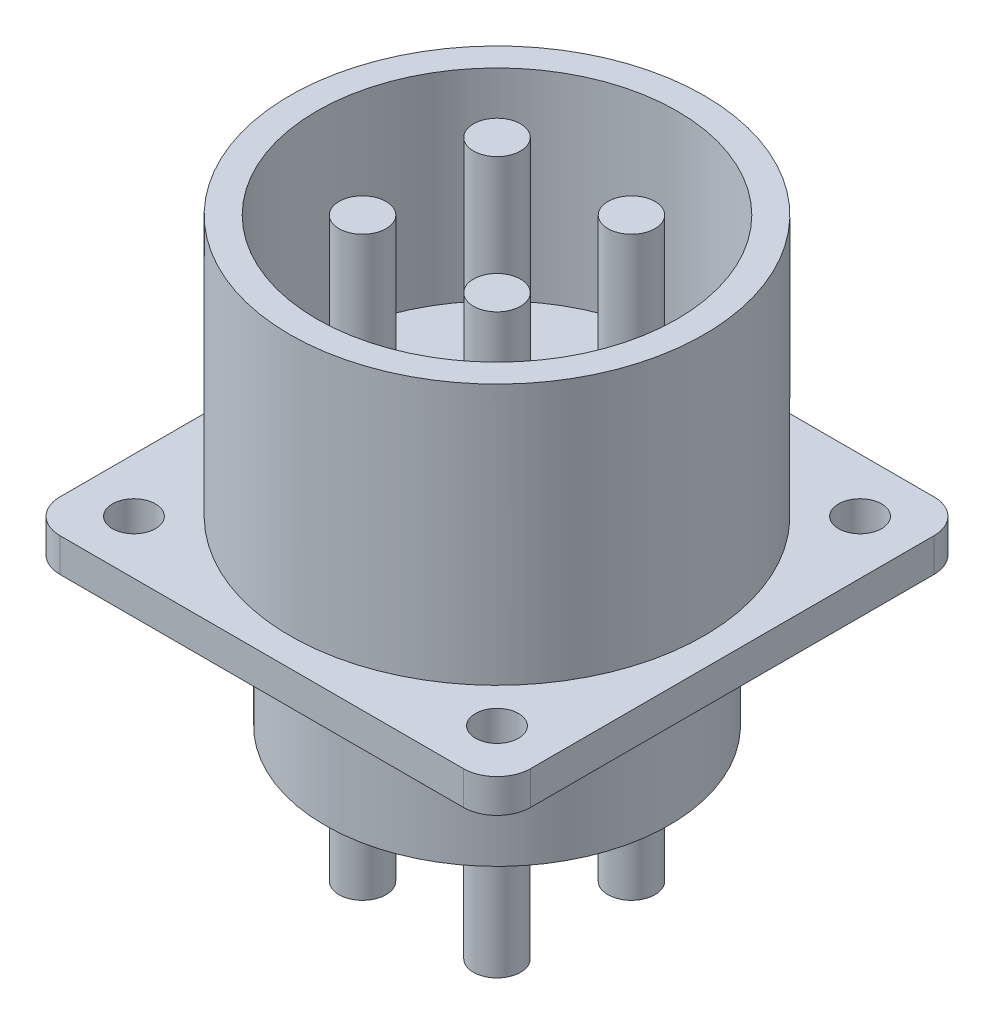
from build123d import *

# Parameters (mm, degrees)
SKETCH1_W           = 35
SKETCH1_H           = 35
BOSS_EXTRUDE1_DEPTH = 2.5
FILLET1_R           = 2.5
SKETCH2_R           = 15.4
BOSS_EXTRUDE2_DEPTH = 19.4
SKETCH3_R           = 12.8
BOSS_EXTRUDE3_DEPTH = 11
SKETCH4_R           = 13.4
CUT_EXTRUDE1_DEPTH  = 15
SKETCH5_R           = 1.75
BOSS_EXTRUDE4_DEPTH = 15
BOSS_EXTRUDE5_START = 10
SKETCH6_R           = 1.75
BOSS_EXTRUDE5_DEPTH = 10
SKETCH7_R           = 1.6
CUT_EXTRUDE2_DEPTH  = 35.128433893


with BuildPart() as part:
    # Sketch1 → Boss-Extrude1 (new body)
    with BuildSketch(Plane(origin=(0, 0, 0), x_dir=(1, 0, 0), z_dir=(0, 1, 0))):
        Rectangle(SKETCH1_W, SKETCH1_H)
    extrude(amount=BOSS_EXTRUDE1_DEPTH)

    # Fillet1
    fillet1_edges = [part.edges().sort_by_distance(p)[0] for p in [
        (17.5, 1.25, 17.5),
        (-17.5, 1.25, 17.5),
        (-17.5, 1.25, -17.5),
        (17.5, 1.25, -17.5),
    ]]
    fillet(fillet1_edges, radius=FILLET1_R)

    # Sketch2 → Boss-Extrude2 (add)
    with BuildSketch(Plane(origin=(0, 2.5, 0), x_dir=(1, 0, 0), z_dir=(0, 1, 0))):
        with Locations(Location((0, 0, 0), (0, 0, 90))):
            Circle(SKETCH2_R)
    extrude(amount=BOSS_EXTRUDE2_DEPTH)

    # Sketch3 → Boss-Extrude3 (add)
    with BuildSketch(Plane.XZ):
        with Locations(Location((0, 0, 0), (0, 0, 270))):
            Circle(SKETCH3_R)
    extrude(amount=BOSS_EXTRUDE3_DEPTH)

    # Sketch4 → Cut-Extrude1 (cut)
    with BuildSketch(Plane(origin=(0, 21.9, 0), x_dir=(1, 0, 0), z_dir=(0, 1, 0))):
        with Locations(Location((0, 0, 0), (0, 0, 270))):
            Circle(SKETCH4_R)
    extrude(amount=-CUT_EXTRUDE1_DEPTH, mode=Mode.SUBTRACT)

    # Sketch5 → Boss-Extrude4 (add)
    with BuildSketch(Plane(origin=(0, 6.9, 0), x_dir=(1, 0, 0), z_dir=(0, 1, 0))):
        with Locations(Location((-5, 5, 0), (0, 0, 270))):
            Circle(SKETCH5_R)
        with Locations(Location((-5, -5, 0), (0, 0, 270))):
            Circle(SKETCH5_R)
        with Locations(Location((5, -5, 0), (0, 0, 270))):
            Circle(SKETCH5_R)
        with Locations(Location((5, 5, 0), (0, 0, 270))):
            Circle(SKETCH5_R)
    extrude(amount=BOSS_EXTRUDE4_DEPTH)

    # Sketch6 → Boss-Extrude5 (add)
    with BuildSketch(Plane.XZ.offset(11).offset(BOSS_EXTRUDE5_START)):
        with Locations(Location((5, -5, 0), (0, 0, 90))):
            Circle(SKETCH6_R)
        with Locations(Location((5, 5, 0), (0, 0, 90))):
            Circle(SKETCH6_R)
        with Locations(Location((-5, 5, 0), (0, 0, 90))):
            Circle(SKETCH6_R)
        with Locations(Location((-5, -5, 0), (0, 0, 90))):
            Circle(SKETCH6_R)
    extrude(amount=-BOSS_EXTRUDE5_DEPTH)

    # Sketch7 → Cut-Extrude2 (cut, through all)
    with BuildSketch(Plane(origin=(0, 2.5, 0), x_dir=(1, 0, 0), z_dir=(0, 1, 0))):
        with Locations(Location((-13.5, 13.5, 0), (0, 0, 270))):
            Circle(SKETCH7_R)
        with Locations(Location((-13.5, -13.5, 0), (0, 0, 270))):
            Circle(SKETCH7_R)
        with Locations(Location((13.5, -13.5, 0), (0, 0, 270))):
            Circle(SKETCH7_R)
        with Locations(Location((13.5, 13.5, 0), (0, 0, 270))):
            Circle(SKETCH7_R)
    extrude(amount=-CUT_EXTRUDE2_DEPTH, mode=Mode.SUBTRACT)


solid = part.part
